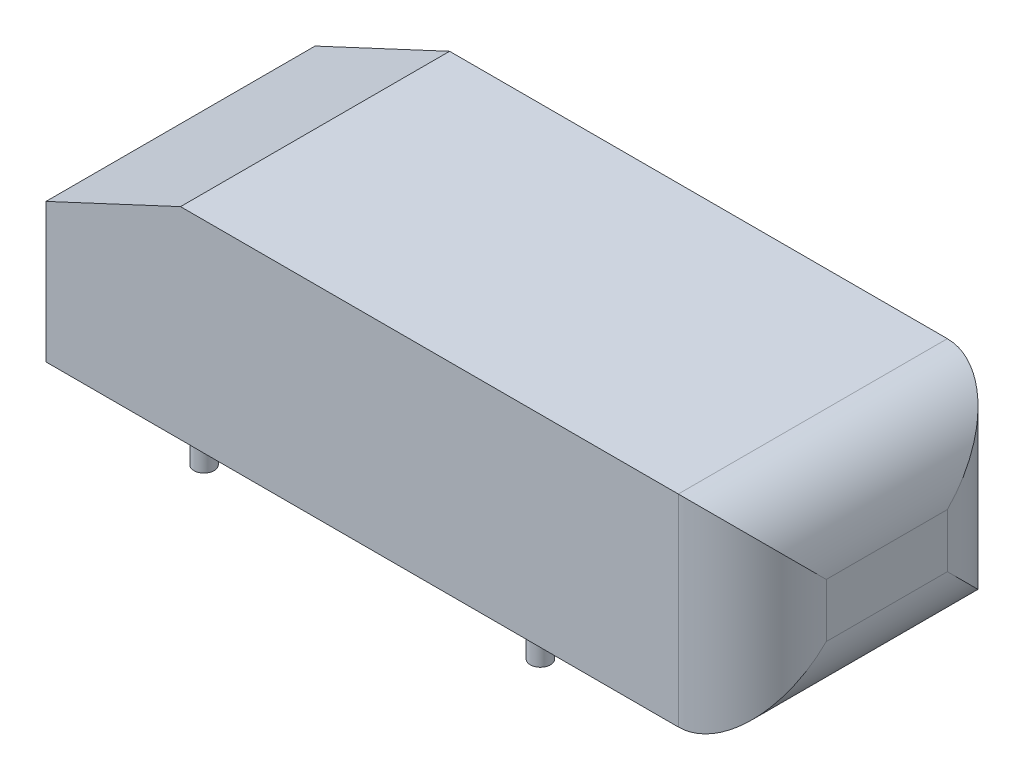
from build123d import *

# Parameters (mm, degrees)
SKETCH3_W           = 400
SKETCH3_H           = 300
BOSS_EXTRUDE2_DEPTH = 1050
FILLET1_R           = 110
CHAMFER1_SIZE       = 200
CHAMFER1_SIZE2      = 93.261531631
SKETCH4_R           = 15
BOSS_EXTRUDE3_DEPTH = 50


with BuildPart() as part:
    # Sketch3 → Boss-Extrude2 (new body)
    with BuildSketch(Plane(origin=(0, 0, 0), x_dir=(0, 0, -1), z_dir=(1, 0, 0))):
        with Locations((0, 200)):
            Rectangle(SKETCH3_W, SKETCH3_H)
    extrude(amount=-BOSS_EXTRUDE2_DEPTH)

    # Fillet1
    fillet1_edges = [part.edges().sort_by_distance(p)[0] for p in [
        (0, 350, 0),
        (0, 200, -200),
        (0, 50, 0),
        (0, 200, 200),
    ]]
    fillet(fillet1_edges, radius=FILLET1_R)

    # Chamfer1
    chamfer1_edges = [part.edges().sort_by_distance(p)[0] for p in [
        (-1050, 350, 0),
    ]]
    chamfer1_side = [part.faces().sort_by_distance(p)[0] for p in [
        (-580, 350, 0),
    ]]
    chamfer(chamfer1_edges, length=CHAMFER1_SIZE, length2=CHAMFER1_SIZE2, reference=chamfer1_side[0])

    # Sketch4 → Boss-Extrude3 (add)
    with BuildSketch(Plane.XZ.offset(-50)):
        with Locations(Location((-850, 165, 0), (0, 0, 270))):
            Circle(SKETCH4_R)
        with Locations(Location((-350, 165, 0), (0, 0, 270))):
            Circle(SKETCH4_R)
        with Locations(Location((-350, -165, 0), (0, 0, 90))):
            Circle(SKETCH4_R)
        with Locations(Location((-850, -165, 0), (0, 0, 90))):
            Circle(SKETCH4_R)
    extrude(amount=BOSS_EXTRUDE3_DEPTH)


solid = part.part
